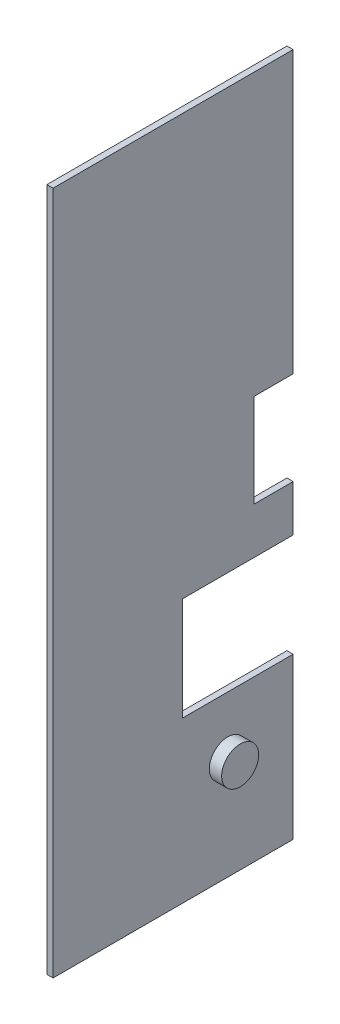
from build123d import *

# Parameters (mm, degrees)
SKETCH_1_W          = 110.7
SKETCH_1_H          = 38.85
EXTRUDE_1_DEPTH     = 0.5
SKETCH_2_W          = 38.85
SKETCH_2_H          = 110.7
EXTRUDE_2_DEPTH     = 0.5
SKETCH_3_W          = 17.932827047
SKETCH_3_H          = 16.708777413
CUT_EXTRUDE_1_DEPTH = 10
SKETCH_4_W          = 6.338485403
SKETCH_4_H          = 15.09561221
CUT_EXTRUDE_2_DEPTH = 3
SKETCH_5_R          = 1.379738623
CUT_EXTRUDE_3_DEPTH = 3
SKETCH_6_R          = 3.000043017
SKETCH_6_R_2        = 2.273503066
EXTRUDE_3_DEPTH     = 1
SKETCH_7_R          = 3.000043017
EXTRUDE_4_DEPTH     = 1


with BuildPart() as part:
    # Эскиз1 → Бобышка-Вытянуть1 (new body)
    with BuildSketch(Plane(origin=(0.5, 0, 0), x_dir=(0, -1, 0), z_dir=(-1, 0, 0))):
        with Locations((-45.5, 22.825)):
            Rectangle(SKETCH_1_W, SKETCH_1_H)
    extrude(amount=-EXTRUDE_1_DEPTH)

    # Эскиз2 → Бобышка-Вытянуть2 (add)
    with BuildSketch(Plane.ZY.offset(-0.5)):
        with Locations((22.825, 45.5)):
            Rectangle(SKETCH_2_W, SKETCH_2_H)
    extrude(amount=EXTRUDE_2_DEPTH)

    # Эскиз3 → Вырез-Вытянуть1 (cut)
    with BuildSketch(Plane.ZY):
        with Locations((12.366413524, 24.461489881)):
            Rectangle(SKETCH_3_W, SKETCH_3_H)
    extrude(amount=-CUT_EXTRUDE_1_DEPTH, mode=Mode.SUBTRACT)

    # Эскиз4 → Вырез-Вытянуть2 (cut)
    with BuildSketch(Plane.ZY):
        with Locations((6.569242702, 47.853484542)):
            Rectangle(SKETCH_4_W, SKETCH_4_H)
    extrude(amount=-CUT_EXTRUDE_2_DEPTH, mode=Mode.SUBTRACT)

    # Эскиз5 → Вырез-Вытянуть3 (cut)
    with BuildSketch(Plane.ZY):
        with Locations((13.967872297, 6.805635325)):
            Circle(SKETCH_5_R)
    extrude(amount=-CUT_EXTRUDE_3_DEPTH, mode=Mode.SUBTRACT)

    # Эскиз6 → Бобышка-Вытянуть3 (add)
    with BuildSketch(Plane(origin=(1, 0, 0), x_dir=(0, 0, -1), z_dir=(1, 0, 0))):
        with Locations(Location((-13.967872297, 6.805635325, 0), (0, 0, 180))):
            Circle(SKETCH_6_R)
        with Locations((-13.967872297, 6.805635325)):
            Circle(SKETCH_6_R_2, mode=Mode.SUBTRACT)
    extrude(amount=EXTRUDE_3_DEPTH)

    # Эскиз7 → Бобышка-Вытянуть4 (add)
    with BuildSketch(Plane(origin=(2, 0, 0), x_dir=(0, 0, -1), z_dir=(1, 0, 0))):
        with Locations(Location((-13.967872297, 6.805635325, 0), (0, 0, 180))):
            Circle(SKETCH_7_R)
    extrude(amount=EXTRUDE_4_DEPTH)


solid = part.part
